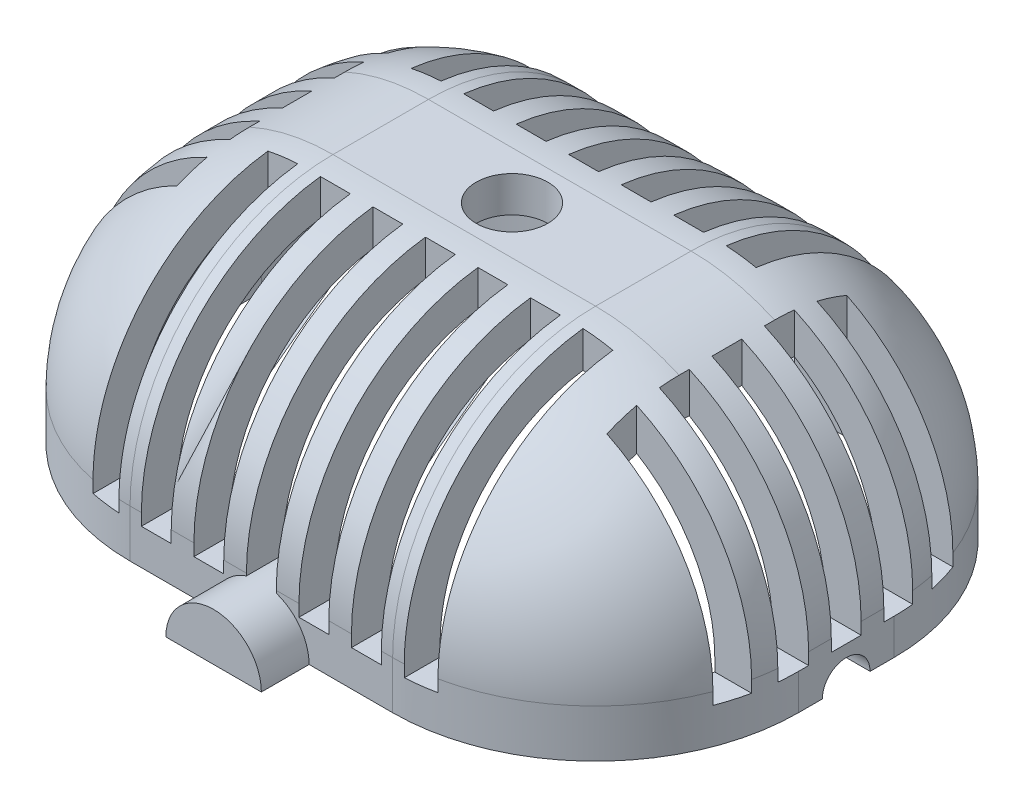
from build123d import *

# Parameters (mm, degrees)
SKETCH_1_W          = 25
SKETCH_1_H          = 18
EXTRUDE_1_DEPTH     = 9
FILLET_1_R          = 7
SHELL_2_T           = 1.5
SKETCH_2_W          = 1.25
SKETCH_2_H          = 15
SKETCH_2_R          = 1.5
CUT_EXTRUDE_1_DEPTH = 9
SKETCH_3_W          = 12.663963224
SKETCH_3_H          = 1.25
CUT_EXTRUDE_2_DEPTH = 9
EXTRUDE_2_DEPTH     = 3.5
CUT_EXTRUDE_3_REACH = 34.411


with BuildPart() as part:
    # Эскиз1 → Бобышка-Вытянуть1 (new body)
    with BuildSketch(Plane(origin=(0, 0, 0), x_dir=(1, 0, 0), z_dir=(0, 1, 0))):
        Rectangle(SKETCH_1_W, SKETCH_1_H)
    extrude(amount=EXTRUDE_1_DEPTH)

    # Скругление1
    fillet_1_edges = [part.edges().sort_by_distance(p)[0] for p in [
        (12.5, 9, 0),
        (0, 9, -9),
        (-12.5, 9, 0),
        (0, 9, 9),
        (-12.5, 4.5, -9),
        (12.5, 4.5, -9),
        (12.5, 4.5, 9),
        (-12.5, 4.5, 9),
    ]]
    fillet(fillet_1_edges, radius=FILLET_1_R)

    # Оболочка2
    shell_2_openings = [part.faces().sort_by_distance(p)[0] for p in [
        (0, 0, 0),
    ]]
    offset(amount=SHELL_2_T, openings=shell_2_openings, kind=Kind.INTERSECTION)

    # Эскиз2 → Вырез-Вытянуть1 (cut)
    with BuildSketch(Plane(origin=(0, 10.5, 0), x_dir=(1, 0, 0), z_dir=(0, 1, 0))):
        with Locations((2.2, 10.5)):
            Rectangle(SKETCH_2_W, SKETCH_2_H)
        with Locations((4.4, 10.5)):
            Rectangle(SKETCH_2_W, SKETCH_2_H)
        with Locations((6.6, 10.5)):
            Rectangle(SKETCH_2_W, SKETCH_2_H)
        with Locations((0, 10.5)):
            Rectangle(SKETCH_2_W, SKETCH_2_H)
        with Locations((-2.2, 10.5)):
            Rectangle(SKETCH_2_W, SKETCH_2_H)
        with Locations((-4.4, 10.5)):
            Rectangle(SKETCH_2_W, SKETCH_2_H)
        with Locations((-6.6, 10.5)):
            Rectangle(SKETCH_2_W, SKETCH_2_H)
        with Locations(Location((0, 0, 0), (0, 0, 270))):
            Circle(SKETCH_2_R)
    cut_extrude_1 = extrude(amount=-CUT_EXTRUDE_1_DEPTH, mode=Mode.SUBTRACT)

    # Эскиз3 → Вырез-Вытянуть2 (cut)
    with BuildSketch(Plane(origin=(0, 10.5, 0), x_dir=(1, 0, 0), z_dir=(0, 1, 0))):
        with Locations((-15.331981612, -2.2)):
            Rectangle(SKETCH_3_W, SKETCH_3_H)
        with Locations((-15.331981612, 0)):
            Rectangle(SKETCH_3_W, SKETCH_3_H)
        with Locations((-15.331981612, 2.2)):
            Rectangle(SKETCH_3_W, SKETCH_3_H)
        with Locations((-15.331981612, 4.4)):
            Rectangle(SKETCH_3_W, SKETCH_3_H)
        with Locations((-15.331981612, -4.4)):
            Rectangle(SKETCH_3_W, SKETCH_3_H)
    cut_extrude_2 = extrude(amount=-CUT_EXTRUDE_2_DEPTH, mode=Mode.SUBTRACT)

    # Зеркальное отражение1: Вырез-Вытянуть1 across plane
    add(cut_extrude_1.mirror(Plane.XY), mode=Mode.SUBTRACT)

    # Зеркальное отражение2: Вырез-Вытянуть2 across plane
    add(cut_extrude_2.mirror(Plane(origin=(0, 0, 0), x_dir=(0, 0, 1), z_dir=(1, 0, 0))), mode=Mode.SUBTRACT)

    # Эскиз5 → Бобышка-Вытянуть2 (add)
    with BuildSketch(Plane.XY.offset(-9)):
        with BuildLine():
            Line((-2, 0), (2, 0))
            ThreePointArc((2, 0), (0, 2), (-2, 0))
        make_face()
    extrude_2 = extrude(amount=-EXTRUDE_2_DEPTH)

    # Зеркальное отражение3: Бобышка-Вытянуть2 across plane
    add(extrude_2.mirror(Plane.XY))

    # Эскиз6 → Вырез-Вытянуть3 (cut, up to next)
    with BuildSketch(Plane(origin=(14, 0, 0), x_dir=(0, 0, -1), z_dir=(1, 0, 0)), mode=Mode.PRIVATE) as cut_extrude_3_sk1:
        with BuildLine():
            Line((-1, 0), (1, 0))
            ThreePointArc((1, 0), (0, 1), (-1, 0))
        make_face()
    cut_extrude_3_tool1 = extrude(cut_extrude_3_sk1.sketch, amount=-CUT_EXTRUDE_3_REACH, mode=Mode.PRIVATE) & part.part
    add(cut_extrude_3_tool1.solids().sort_by_distance((14, 0.424413, 0))[0], mode=Mode.SUBTRACT)


solid = part.part
